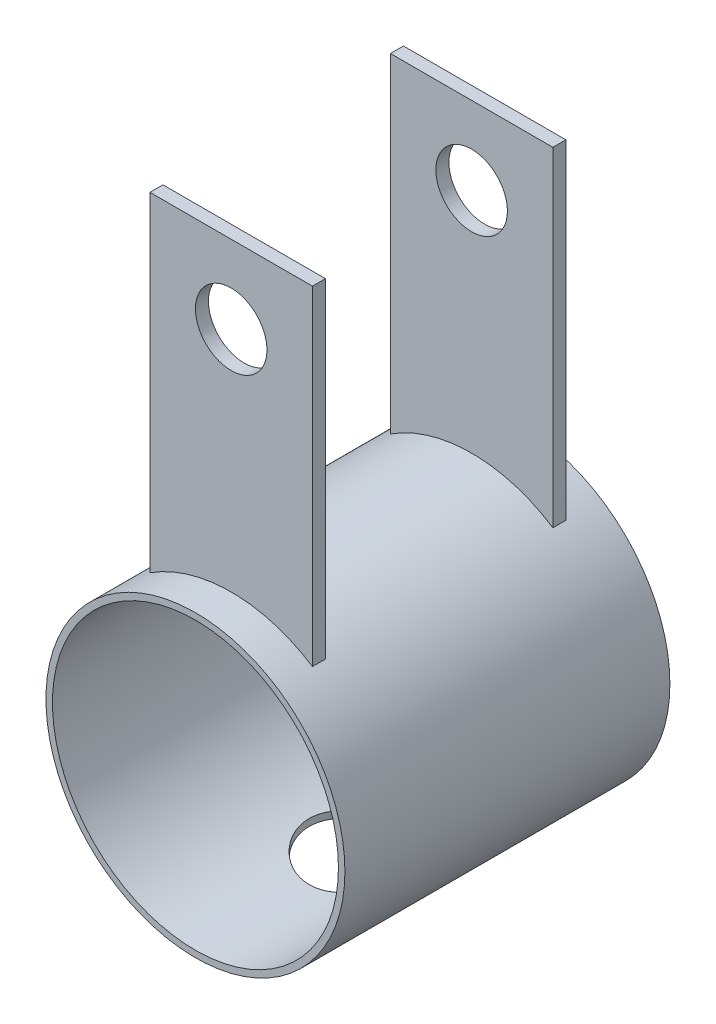
from build123d import *

# Parameters (mm, degrees)
ESBO_O1_R                = 23
ESBO_O1_R_2              = 22
RESSALTO_EXTRUS_O1_DEPTH = 50
ESBO_O2_R                = 7.5
CORTE_EXTRUS_O1_DEPTH    = 50
RESSALTO_EXTRUS_O2_DEPTH = 70
ESBO_O4_R                = 22
CORTE_EXTRUS_O2_DEPTH    = 70
ESBO_O7_R                = 5.5
CORTE_EXTRUS_O4_DEPTH    = 70


with BuildPart() as part:
    # Esboço1 → Ressalto-extrusão1 (new body)
    with BuildSketch(Plane.XY):
        Circle(ESBO_O1_R)
        Circle(ESBO_O1_R_2, mode=Mode.SUBTRACT)
    extrude(amount=RESSALTO_EXTRUS_O1_DEPTH)

    # Esboço2 → Corte-extrusão1 (cut)
    with BuildSketch(Plane(origin=(0, 0, 0), x_dir=(1, 0, 0), z_dir=(0, 1, 0))):
        with Locations(Location((0, -25, 0), (0, 0, 270))):
            Circle(ESBO_O2_R)
    extrude(amount=-CORTE_EXTRUS_O1_DEPTH, mode=Mode.SUBTRACT)

    # Esboço3 → Ressalto-extrusão2 (add)
    with BuildSketch(Plane(origin=(0, 0, 0), x_dir=(1, 0, 0), z_dir=(0, 1, 0))):
        Polygon((0, -7.5), (-12.5, -7.5), (-12.5, -5.5), (12.5, -5.5), (12.5, -7.5), align=None)
        Polygon((0, -42.5), (-12.5, -42.5), (-12.5, -44.5), (12.5, -44.5), (12.5, -42.5), align=None)
    extrude(amount=RESSALTO_EXTRUS_O2_DEPTH)

    # Esboço4 → Corte-extrusão2 (cut)
    with BuildSketch(Plane(origin=(0, 0, 5.5), x_dir=(-1, 0, 0), z_dir=(0, 0, -1))):
        with Locations(Location((0, 0, 0), (0, 0, 180))):
            Circle(ESBO_O4_R)
    extrude(amount=-CORTE_EXTRUS_O2_DEPTH, mode=Mode.SUBTRACT)

    # Esboço7 → Corte-extrusão4 (cut)
    with BuildSketch(Plane(origin=(0, 0, 5.5), x_dir=(-1, 0, 0), z_dir=(0, 0, -1))):
        with Locations((0, 58)):
            Circle(ESBO_O7_R)
    extrude(amount=-CORTE_EXTRUS_O4_DEPTH, mode=Mode.SUBTRACT)


solid = part.part
